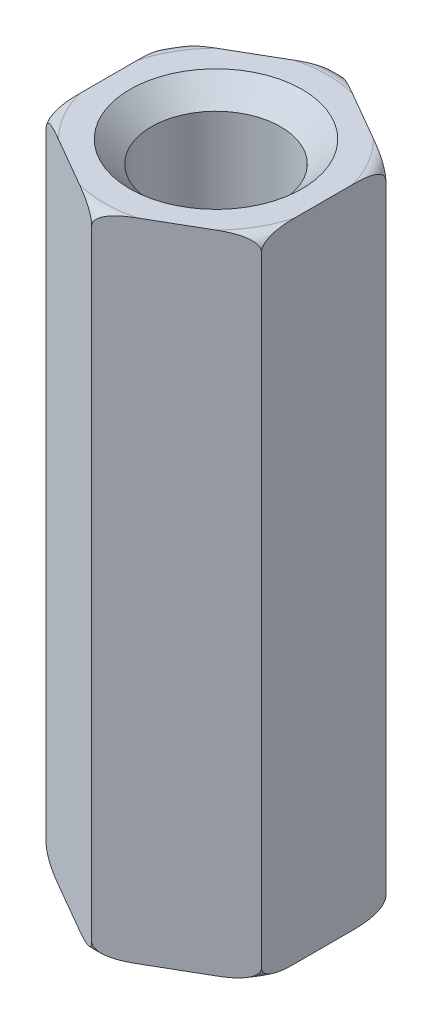
from build123d import *

# Parameters (mm, degrees)
SKETCH2_R           = 1.5
BOSS_EXTRUDE2_DEPTH = 7.5
CHAMFER1_SIZE       = 0.5


with BuildPart() as part:
    # Sketch2 → Boss-Extrude2 (new, symmetric)
    with BuildSketch(Plane(origin=(0, 0, 0), x_dir=(1, 0, 0), z_dir=(0, 1, 0))):
        Polygon((0, -2.886751346), (2.5, -1.443375673), (2.5, 1.443375673), (0, 2.886751346), (-2.5, 1.443375673), (-2.5, -1.443375673), align=None)
        with Locations(Location((0, 0, 0), (0, 0, 270))):
            Circle(SKETCH2_R, mode=Mode.SUBTRACT)
    extrude(amount=BOSS_EXTRUDE2_DEPTH, both=True)

    # Chamfer1
    chamfer1_edges = [part.edges().sort_by_distance(p)[0] for p in [
        (0, -7.5, -1.5),
        (0, 7.5, -1.5),
    ]]
    chamfer(chamfer1_edges, length=CHAMFER1_SIZE)

    # Sketch4 → Cut-Revolve1 (revolve, cut)
    with BuildSketch(Plane(origin=(0, 0, 0), x_dir=(0, 0, -1), z_dir=(1, 0, 0))):
        with BuildLine():
            Line((-2.886751346, 7.2), (-2.886751346, 7.5))
            Line((-2.886751346, 7.5), (-2.586751346, 7.5))
            ThreePointArc((-2.586751346, 7.5), (-2.79888338, 7.412132034), (-2.886751346, 7.2))
        make_face()
    cut_revolve1 = revolve(axis=Axis((0, 57.75, 0), (0, -1, 0)), mode=Mode.SUBTRACT)

    # Mirror1: Cut-Revolve1 across plane
    add(cut_revolve1.mirror(Plane.ZX), mode=Mode.SUBTRACT)


solid = part.part
